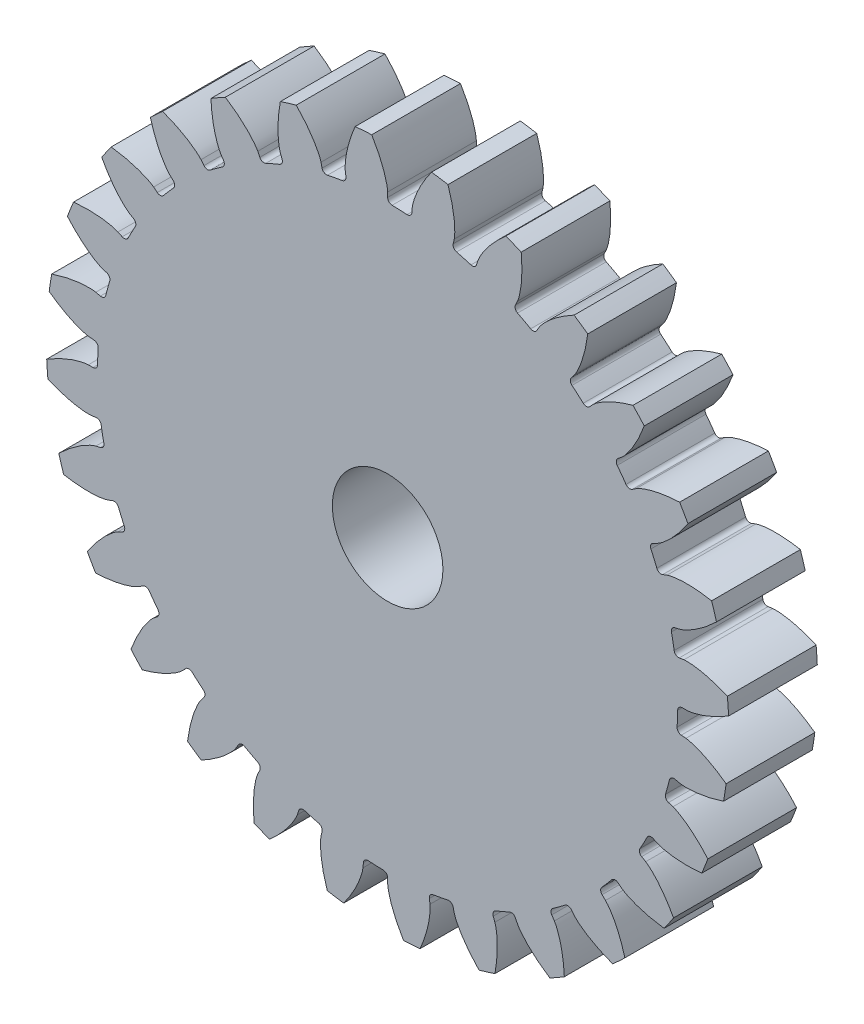
from build123d import *

# Parameters (mm, degrees)
SKETCH3_R           = 7.5
BOSS_EXTRUDE1_DEPTH = 1.95
CUT_EXTRUDE1_DEPTH  = 11.784363681
CIRPATTERN1_COUNT   = 28
FILLET1_R           = 0.1
SKETCH8_R           = 1.215
CUT_EXTRUDE2_DEPTH  = 11.773023417


with BuildPart() as part:
    # Sketch3 → Boss-Extrude1 (new body)
    with BuildSketch(Plane.XY):
        Circle(SKETCH3_R)
    extrude(amount=BOSS_EXTRUDE1_DEPTH)

    # Sketch4 → Cut-Extrude1 (cut, symmetric)
    with BuildSketch(Plane.XY):
        with BuildLine():
            Line((6.577848346, 0), (6.375, 0))
            ThreePointArc((6.375, 0), (6.369591361, -0.262546942), (6.353374621, -0.524648387))
            Line((6.353374621, -0.524648387), (6.555534861, -0.541342356))
            add(Edge.make_bspline(
                [(6.555534861, -0.541342356), (6.557773233, -0.541559658), (6.564041488, -0.542268848), (6.583333605, -0.545102055), (6.621156511, -0.552495504), (6.66744877, -0.564202917), (6.720216391, -0.580113939), (6.770723229, -0.597387227), (6.8136287, -0.613339792), (6.856152915, -0.630349858), (6.898253259, -0.648280366), (6.948923681, -0.671158277), (7.009216243, -0.700197652), (7.078960655, -0.736461425), (7.157164195, -0.780315331), (7.235840332, -0.827892531), (7.312392007, -0.877067977), (7.372840553, -0.918560664), (7.412950453, -0.947039796), (7.43453102, -0.962717184), (7.437659565, -0.964997509)],
                knots=[0, 0, 0, 0, 0, 0.005376749, 0.015083688, 0.04661014, 0.092110525, 0.119476176, 0.146842496, 0.174208854, 0.201574956, 0.228941013, 0.256307345, 0.307035032, 0.361767352, 0.416499661, 0.471231937, 0.525964282, 0.580696616, 0.58997764, 0.58997764, 0.58997764, 0.58997764, 0.58997764], degree=4))
            ThreePointArc((7.437659565, -0.964997509), (7.484398665, -0.48350453), (7.5, 0))
            ThreePointArc((7.5, 0), (7.497961366, 0.174858086), (7.491846573, 0.349621112))
            add(Edge.make_bspline(
                [(6.577848346, 0), (6.580097008, 3.2351e-05), (6.586402365, 0.000223272), (6.605862206, 0.00145917), (6.644165272, 0.005714797), (6.691263992, 0.013572746), (6.745162056, 0.025087136), (6.796919117, 0.038145228), (6.840991904, 0.050512653), (6.884771759, 0.063965368), (6.928204931, 0.078370287), (6.980586269, 0.097000528), (7.043064182, 0.120979451), (7.115556434, 0.151380399), (7.19710377, 0.188649564), (7.279428518, 0.2295905), (7.359767544, 0.272299099), (7.423425791, 0.308676253), (7.465743399, 0.333757821), (7.488540975, 0.347605995), (7.491846573, 0.349621112)],
                knots=[0, 0, 0, 0, 0, 0.005376749, 0.015083688, 0.04661014, 0.092110525, 0.119476176, 0.146842496, 0.174208854, 0.201574956, 0.228941013, 0.256307345, 0.307035032, 0.361767352, 0.416499661, 0.471231937, 0.525964282, 0.580696616, 0.58997764, 0.58997764, 0.58997764, 0.58997764, 0.58997764], degree=4))
        make_face()
    cut_extrude1 = extrude(amount=CUT_EXTRUDE1_DEPTH, both=True, mode=Mode.SUBTRACT)

    # CirPattern1: Cut-Extrude1 ×28 about axis
    cirpattern1_axis = Axis((0, 0, 1.95), (0, 0, 1))
    for i in range(1, CIRPATTERN1_COUNT):
        add(cut_extrude1.rotate(cirpattern1_axis, i * 360 / CIRPATTERN1_COUNT), mode=Mode.SUBTRACT)

    # Fillet1
    fillet1_edges = [part.edges().sort_by_distance(p)[0] for p in [
        (4.371450909, 4.64015538, 0.975),
        (3.974747487, 4.984175701, 0.975),
        (6.353374621, -0.524648387, 0.975),
        (3.229317799, 5.496556336, 0.975),
        (2.766008837, 5.743676533, 0.975),
        (6.375, 0, 0.975),
        (1.925253211, 6.077337005, 0.975),
        (1.418570954, 6.21516544, 0.975),
        (0.524648387, 6.353374621, 0.975),
        (0, 6.375, 0.975),
        (-0.902264498, 6.310827503, 0.975),
        (-1.418570954, 6.21516544, 0.975),
        (-2.283934073, 5.951829143, 0.975),
        (-2.766008837, 5.743676533, 0.975),
        (-3.551077657, 5.294381217, 0.975),
        (-3.974747487, 4.984175701, 0.975),
        (-4.64015538, 4.371450909, 0.975),
        (-4.984175701, 3.974747487, 0.975),
        (-5.496556336, 3.229317799, 0.975),
        (-5.743676533, 2.766008837, 0.975),
        (-6.077337005, 1.925253211, 0.975),
        (-6.21516544, 1.418570954, 0.975),
        (-6.353374621, 0.524648387, 0.975),
        (-6.375, 0, 0.975),
        (-6.310827503, -0.902264498, 0.975),
        (-6.21516544, -1.418570954, 0.975),
        (6.310827503, 0.902264498, 0.975),
        (-5.951829143, -2.283934073, 0.975),
        (6.21516544, 1.418570954, 0.975),
        (-5.743676533, -2.766008837, 0.975),
        (-5.294381217, -3.551077657, 0.975),
        (-4.984175701, -3.974747487, 0.975),
        (-4.371450909, -4.64015538, 0.975),
        (-3.974747487, -4.984175701, 0.975),
        (-3.229317799, -5.496556336, 0.975),
        (-2.766008837, -5.743676533, 0.975),
        (-1.925253211, -6.077337005, 0.975),
        (-1.418570954, -6.21516544, 0.975),
        (-0.524648387, -6.353374621, 0.975),
        (0, -6.375, 0.975),
        (0.902264498, -6.310827503, 0.975),
        (1.418570954, -6.21516544, 0.975),
        (2.283934073, -5.951829143, 0.975),
        (2.766008837, -5.743676533, 0.975),
        (3.551077657, -5.294381217, 0.975),
        (3.974747487, -4.984175701, 0.975),
        (4.64015538, -4.371450909, 0.975),
        (4.984175701, -3.974747487, 0.975),
        (5.951829143, 2.283934073, 0.975),
        (5.496556336, -3.229317799, 0.975),
        (5.743676533, 2.766008837, 0.975),
        (5.743676533, -2.766008837, 0.975),
        (6.077337005, -1.925253211, 0.975),
        (6.21516544, -1.418570954, 0.975),
        (5.294381217, 3.551077657, 0.975),
        (4.984175701, 3.974747487, 0.975),
    ]]
    fillet(fillet1_edges, radius=FILLET1_R)

    # Sketch8 → Cut-Extrude2 (cut, through all)
    with BuildSketch(Plane.XY.offset(1.95)):
        Circle(SKETCH8_R)
    extrude(amount=-CUT_EXTRUDE2_DEPTH, mode=Mode.SUBTRACT)


solid = part.part
